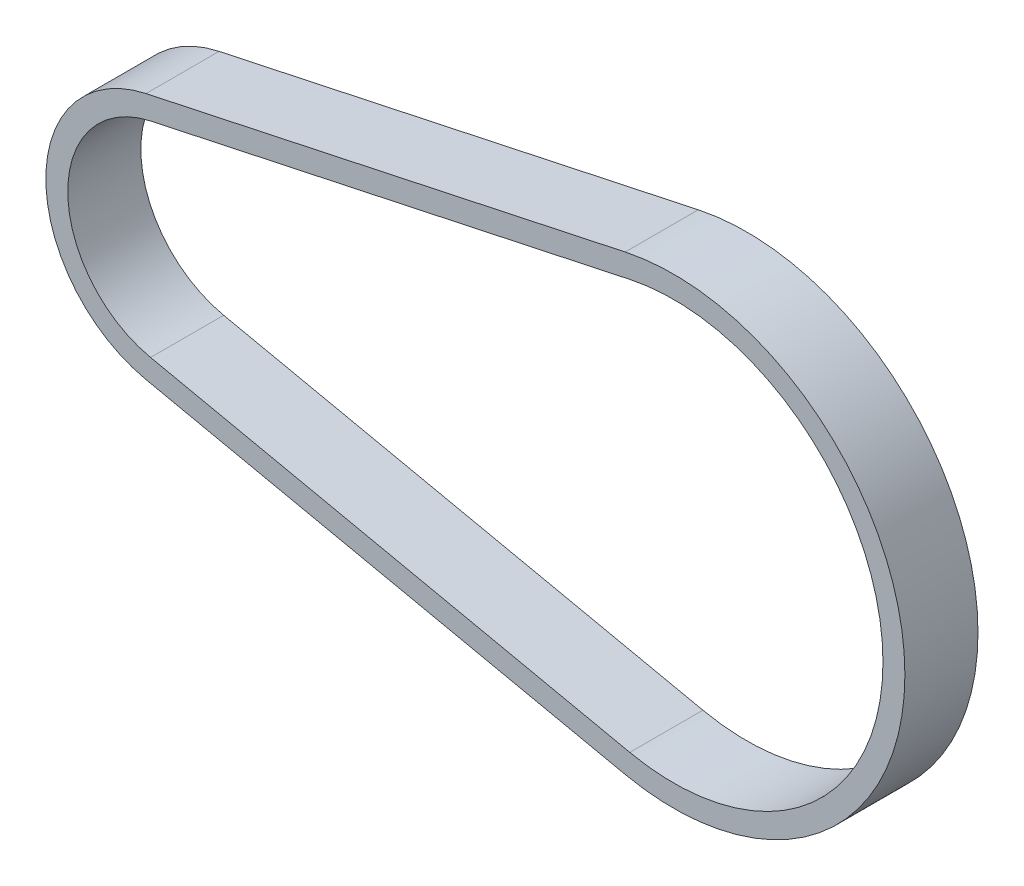
from build123d import *

# Parameters (mm, degrees)
BOSS_EXTRUDE1_DEPTH = 5


with BuildPart() as part:
    # Sketch1 → Boss-Extrude1 (new, symmetric)
    with BuildSketch(Plane.XY):
        with BuildLine():
            Line((-37.895432166, 16.942493793), (27.661050328, 30.951222427))
            ThreePointArc((27.661050328, 30.951222427), (65.925, 0), (27.661050328, -30.951222427))
            Line((27.661050328, -30.951222427), (-37.895432166, -16.942493793))
            ThreePointArc((-37.895432166, -16.942493793), (-51.6, 0), (-37.895432166, 16.942493793))
        make_face()
        with BuildLine():
            Line((-37.268517505, 14.008728634), (28.287964989, 28.017457268))
            ThreePointArc((28.287964989, 28.017457268), (62.925, 0), (28.287964989, -28.017457268))
            Line((28.287964989, -28.017457268), (-37.268517505, -14.008728634))
            ThreePointArc((-37.268517505, -14.008728634), (-48.6, 0), (-37.268517505, 14.008728634))
        make_face(mode=Mode.SUBTRACT)
    extrude(amount=BOSS_EXTRUDE1_DEPTH, both=True)


solid = part.part
